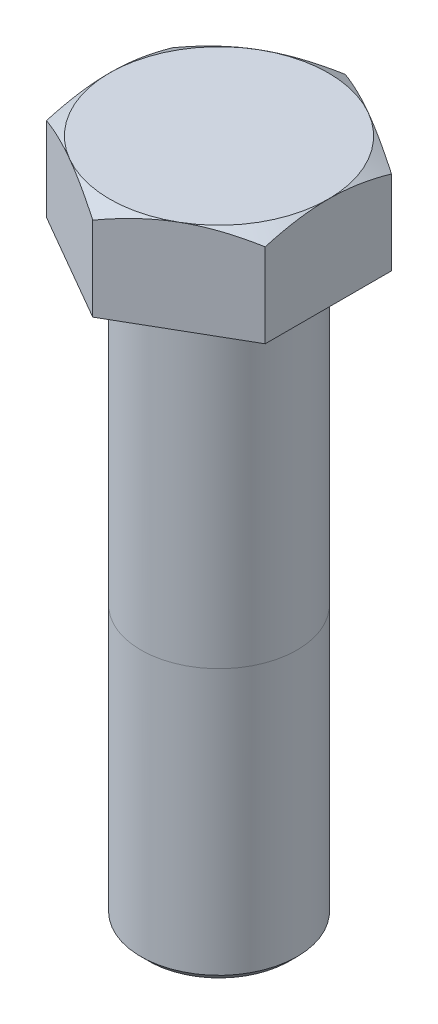
from build123d import *

# Parameters (mm, degrees)
BOSS_EXTRUDE1_DEPTH = 12
SKETCH7_OUTSIDE_W   = 80.454
SKETCH7_OUTSIDE_H   = 84.786
SKETCH7_OUTSIDE_R   = 14
CUT_EXTRUDE1_DEPTH  = 12
CUT_EXTRUDE1_DRAFT  = -60
SKETCH8_R           = 10
BOSS_EXTRUDE2_DEPTH = 75
CHAMFER1_SIZE       = 1


with BuildPart() as part:
    # Sketch6 → Boss-Extrude1 (new body)
    with BuildSketch(Plane(origin=(0, 0, 0), x_dir=(1, 0, 0), z_dir=(0, 1, 0))):
        Polygon((0, 16.165807537), (-14, 8.082903769), (-14, -8.082903769), (0, -16.165807537), (14, -8.082903769), (14, 8.082903769), align=None)
    extrude(amount=BOSS_EXTRUDE1_DEPTH)


with BuildPart() as cut_extrude1_tool:
    # Sketch7 outside → Cut-Extrude1 (with draft: the straight prism first)
    with BuildSketch(Plane(origin=(0, 12, 0), x_dir=(1, 0, 0), z_dir=(0, 1, 0))):
        Rectangle(SKETCH7_OUTSIDE_W, SKETCH7_OUTSIDE_H)
        Circle(SKETCH7_OUTSIDE_R, mode=Mode.SUBTRACT)
    extrude(amount=-CUT_EXTRUDE1_DEPTH)
    # Cut-Extrude1: the draft: its side faces are tilted about the plane it starts from
    cut_extrude1_sides = [cut_extrude1_tool.faces().sort_by_distance(p)[0] for p in [
        (0, 6, 42.393),
        (40.227, 6, 0),
        (0, 6, -42.393),
        (-40.227, 6, 0),
        (-14, 6, 0),
    ]]
    draft(cut_extrude1_sides, Plane(origin=(0, 12, 0), x_dir=(1, 0, 0), z_dir=(0, 1, 0)), CUT_EXTRUDE1_DRAFT)


with BuildPart() as part_1:
    add(part.part)

    # Cut-Extrude1: cut by cut_extrude1_tool
    add(cut_extrude1_tool.part, mode=Mode.SUBTRACT)

    # Sketch8 → Boss-Extrude2 (add)
    with BuildSketch(Plane.XZ):
        with Locations(Location((0, 0, 0), (0, 0, 270))):
            Circle(SKETCH8_R)
    extrude(amount=BOSS_EXTRUDE2_DEPTH)

    # Chamfer1
    chamfer1_edges = [part_1.edges().sort_by_distance(p)[0] for p in [
        (0, -75, 10),
    ]]
    chamfer(chamfer1_edges, length=CHAMFER1_SIZE)


solid = part_1.part
